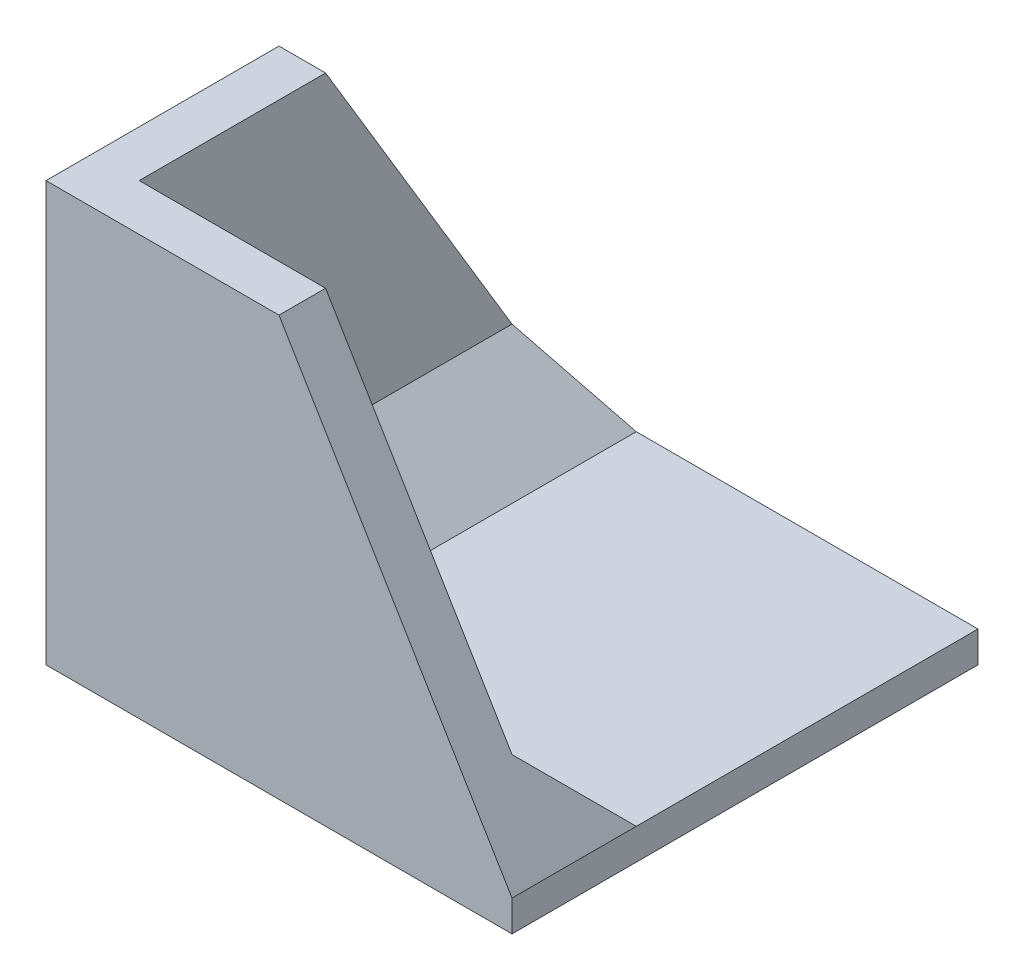
from build123d import *

# Parameters (mm, degrees)
SKETCH1_W           = 38.1
SKETCH1_H           = 38.1
BOSS_EXTRUDE1_DEPTH = 2.54
SKETCH2_W           = 19.05
SKETCH2_H           = 19.05
BOSS_EXTRUDE2_DEPTH = 31.75
BOSS_EXTRUDE3_DEPTH = 3.81
BOSS_EXTRUDE4_DEPTH = 3.81
SKETCH5_W           = 15.24
SKETCH5_H           = 15.24
CUT_EXTRUDE1_DEPTH  = 31.75
CHAMFER5_SIZE       = 6.35


with BuildPart() as part:
    # Sketch1 → Boss-Extrude1 (new body)
    with BuildSketch(Plane(origin=(0, 0, 0), x_dir=(1, 0, 0), z_dir=(0, 1, 0))):
        Rectangle(SKETCH1_W, SKETCH1_H)
    extrude(amount=BOSS_EXTRUDE1_DEPTH)

    # Sketch2 → Boss-Extrude2 (add)
    with BuildSketch(Plane(origin=(0, 2.54, 0), x_dir=(1, 0, 0), z_dir=(0, 1, 0))):
        with Locations((-9.525, -9.525)):
            Rectangle(SKETCH2_W, SKETCH2_H)
    extrude(amount=BOSS_EXTRUDE2_DEPTH)

    # Sketch3 → Boss-Extrude3 (add)
    with BuildSketch(Plane.XY.offset(19.05)):
        Polygon((0, 34.29), (19.05, 2.54), (0, 2.54), align=None)
    extrude(amount=-BOSS_EXTRUDE3_DEPTH)

    # Sketch4 → Boss-Extrude4 (add)
    with BuildSketch(Plane.ZY.offset(19.05)):
        Polygon((0, 34.29), (0, 2.54), (-19.05, 2.54), align=None)
    extrude(amount=-BOSS_EXTRUDE4_DEPTH)

    # Sketch5 → Cut-Extrude1 (cut)
    with BuildSketch(Plane(origin=(0, 34.29, 0), x_dir=(1, 0, 0), z_dir=(0, 1, 0))):
        with Locations((-7.62, -7.62)):
            Rectangle(SKETCH5_W, SKETCH5_H)
    extrude(amount=-CUT_EXTRUDE1_DEPTH, mode=Mode.SUBTRACT)

    # Chamfer5
    chamfer5_edges = [part.edges().sort_by_distance(p)[0] for p in [
        (1.905, 2.54, 15.24),
        (-15.24, 2.54, -1.905),
    ]]
    chamfer(chamfer5_edges, length=CHAMFER5_SIZE)


solid = part.part
